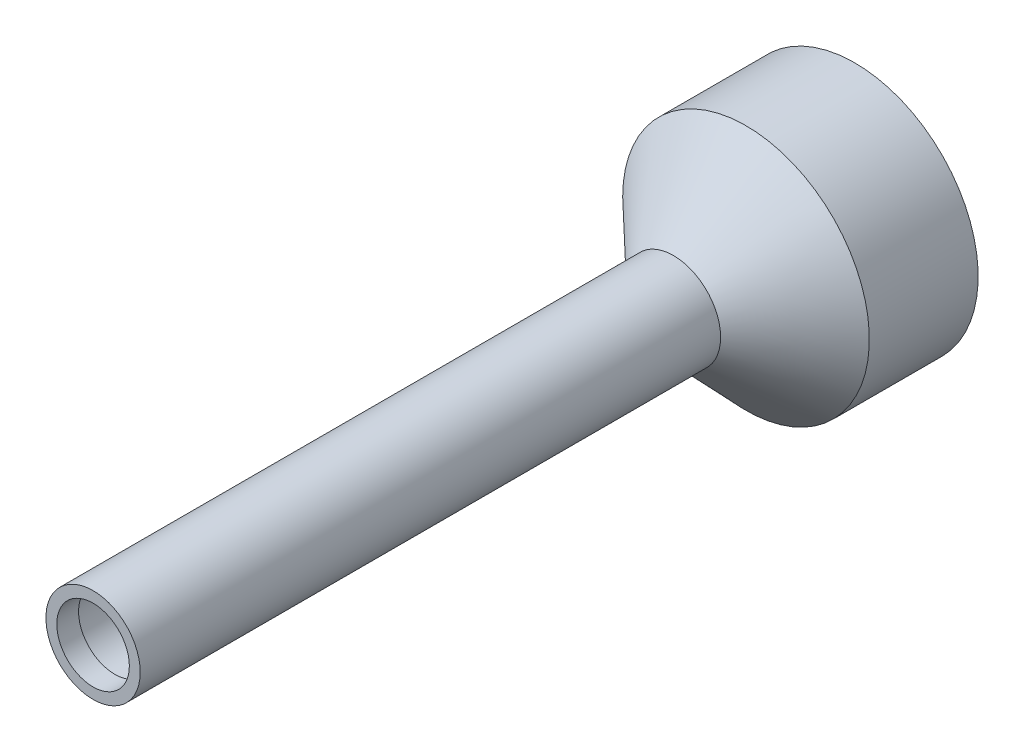
from build123d import *

# Parameters (mm, degrees)
SKETCH1_R           = 17
SKETCH2_R           = 6.5
SKETCH3_R           = 6.5
SKETCH3_R_2         = 5
BOSS_EXTRUDE1_DEPTH = 80
SHELL1_T            = -3
SKETCH4_R           = 5.3
CUT_EXTRUDE1_DEPTH  = 80
SKETCH5_R           = 17
SKETCH5_R_2         = 12.65
BOSS_EXTRUDE2_DEPTH = 15


with BuildPart() as part:
    # Sketch1 → Loft1 section 0
    with BuildSketch(Plane.XY):
        Circle(SKETCH1_R)
    # Sketch2 → Loft1 section 1
    with BuildSketch(Plane.XY.offset(10)):
        Circle(SKETCH2_R)
    loft()

    # Sketch3 → Boss-Extrude1 (add)
    with BuildSketch(Plane.XY.offset(10)):
        Circle(SKETCH3_R)
        Circle(SKETCH3_R_2, mode=Mode.SUBTRACT)
    extrude(amount=BOSS_EXTRUDE1_DEPTH)

    # Shell1
    shell1_openings = [part.faces().sort_by_distance(p)[0] for p in [
        (0, 0, 0),
    ]]
    offset(amount=SHELL1_T, openings=shell1_openings, kind=Kind.INTERSECTION)

    # Sketch4 → Cut-Extrude1 (cut)
    with BuildSketch(Plane(origin=(0, 0, 7), x_dir=(-1, 0, 0), z_dir=(0, 0, -1))):
        Circle(SKETCH4_R)
    extrude(amount=-CUT_EXTRUDE1_DEPTH, mode=Mode.SUBTRACT)

    # Sketch5 → Boss-Extrude2 (add)
    with BuildSketch(Plane(origin=(0, 0, 0), x_dir=(-1, 0, 0), z_dir=(0, 0, -1))):
        Circle(SKETCH5_R)
        Circle(SKETCH5_R_2, mode=Mode.SUBTRACT)
    extrude(amount=BOSS_EXTRUDE2_DEPTH)


solid = part.part
